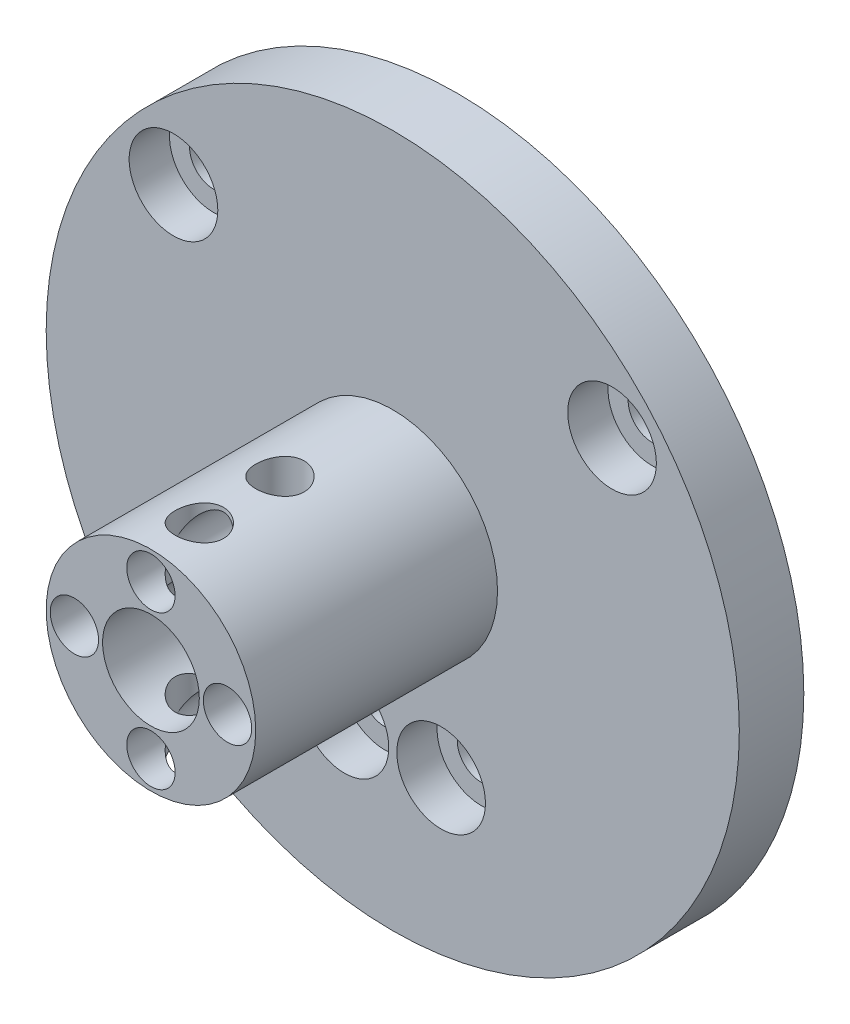
from build123d import *

# Parameters (mm, degrees)
SKETCH2_R           = 21.5
SKETCH2_R_2         = 1.5
SKETCH2_R_3         = 1.499999999
BOSS_EXTRUDE1_DEPTH = 4
SKETCH4_R           = 2.75
CUT_EXTRUDE1_DEPTH  = 2.5
SKETCH6_R           = 6.5
BOSS_EXTRUDE2_DEPTH = 15
SKETCH8_R           = 3
CUT_EXTRUDE2_DEPTH  = 61
SKETCH9_R           = 1.5
CUT_EXTRUDE3_DEPTH  = 8
SKETCH11_R          = 1.5
CUT_EXTRUDE5_DEPTH  = 29.064832946


with BuildPart() as part:
    # Sketch2 → Boss-Extrude1 (new body)
    with BuildSketch(Plane.XY):
        with Locations((4.706896552, 17.280444568)):
            Circle(SKETCH2_R)
        with Locations((-8.895989131, 29.060889133)):
            Circle(SKETCH2_R_2, mode=Mode.SUBTRACT)
        with Locations((18.309782235, 29.060889133)):
            Circle(SKETCH2_R_3, mode=Mode.SUBTRACT)
        with Locations((1.706896552, 5.5)):
            Circle(SKETCH2_R_2, mode=Mode.SUBTRACT)
        with Locations((7.706896552, 5.5)):
            Circle(SKETCH2_R_2, mode=Mode.SUBTRACT)
    extrude(amount=BOSS_EXTRUDE1_DEPTH)

    # Sketch4 → Cut-Extrude1 (cut)
    with BuildSketch(Plane.XY.offset(4)):
        with Locations((-8.895989131, 29.060889133)):
            Circle(SKETCH4_R)
        with Locations((18.309782235, 29.060889133)):
            Circle(SKETCH4_R)
        with Locations((7.706896552, 5.5)):
            Circle(SKETCH4_R)
        with Locations((1.706896552, 5.5)):
            Circle(SKETCH4_R)
    extrude(amount=-CUT_EXTRUDE1_DEPTH, mode=Mode.SUBTRACT)

    # Sketch6 → Boss-Extrude2 (add)
    with BuildSketch(Plane.XY.offset(4)):
        with Locations((4.706896552, 17.280444568)):
            Circle(SKETCH6_R)
    extrude(amount=BOSS_EXTRUDE2_DEPTH)

    # Sketch8 → Cut-Extrude2 (cut)
    with BuildSketch(Plane.XY.offset(19)):
        with Locations((4.706896552, 17.280444568)):
            Circle(SKETCH8_R)
    extrude(amount=-CUT_EXTRUDE2_DEPTH, mode=Mode.SUBTRACT)

    # Sketch9 → Cut-Extrude3 (cut)
    with BuildSketch(Plane.XY.offset(19)):
        with Locations((4.706896552, 22.030444568)):
            Circle(SKETCH9_R)
        with Locations((9.456896552, 17.280444568)):
            Circle(SKETCH9_R)
        with Locations((4.706896552, 12.530444568)):
            Circle(SKETCH9_R)
        with Locations((-0.043103448, 17.280444568)):
            Circle(SKETCH9_R)
    extrude(amount=-CUT_EXTRUDE3_DEPTH, mode=Mode.SUBTRACT)

    # Sketch11 → Cut-Extrude5 (cut)
    with BuildSketch(Plane(origin=(0, 0, 0), x_dir=(1, 0, 0), z_dir=(0, 1, 0))):
        with Locations(Location((4.706896552, -16, 0), (0, 0, 90))):
            Circle(SKETCH11_R)
        with Locations(Location((4.706896552, -11, 0), (0, 0, 90))):
            Circle(SKETCH11_R)
    extrude(amount=CUT_EXTRUDE5_DEPTH, mode=Mode.SUBTRACT)


solid = part.part
